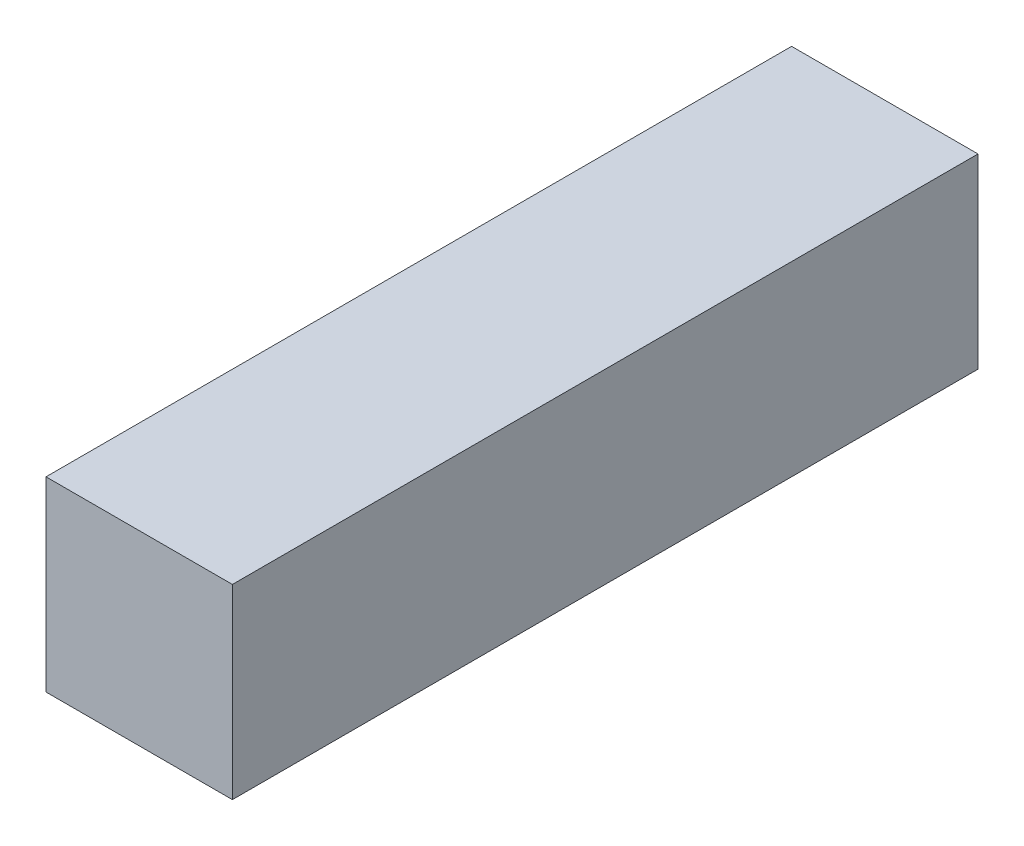
from build123d import *

# Parameters (mm, degrees)
SKETCH1_W           = 3
SKETCH1_H           = 3
BOSS_EXTRUDE1_DEPTH = 12


with BuildPart() as part:
    # Sketch1 → Boss-Extrude1 (new body)
    with BuildSketch(Plane.XY):
        Rectangle(SKETCH1_W, SKETCH1_H)
    extrude(amount=BOSS_EXTRUDE1_DEPTH)


solid = part.part
